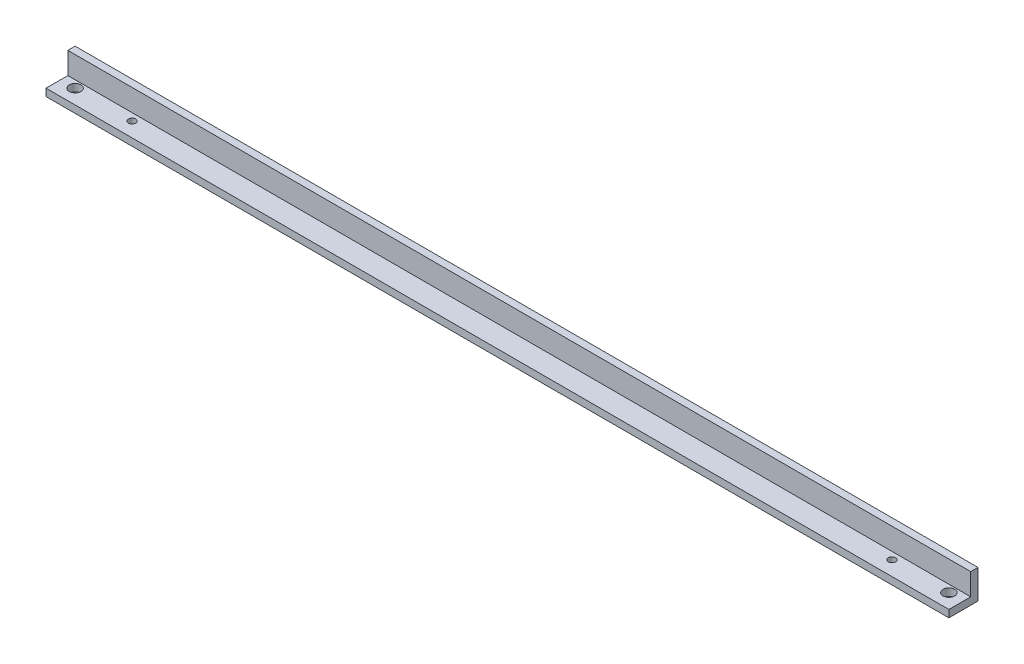
from build123d import *

# Parameters (mm, degrees)
BOSS_EXTRUDE1_DEPTH = 787.4
SKETCH2_R           = 5.08
SKETCH2_R_2         = 3.175
CUT_EXTRUDE1_DEPTH  = 914.4


with BuildPart() as part:
    # Sketch1 → Boss-Extrude1 (new body)
    with BuildSketch(Plane(origin=(0, 0, 0), x_dir=(0, 0, -1), z_dir=(1, 0, 0))):
        Polygon((0, 0), (0, 19.05), (6.35, 19.05), (6.35, -6.35), (-19.05, -6.35), (-19.05, 0), align=None)
    extrude(amount=BOSS_EXTRUDE1_DEPTH)

    # Sketch2 → Cut-Extrude1 (cut)
    with BuildSketch(Plane.XZ.offset(6.35)):
        with Locations(Location((12.7, 6.35, 0), (0, 0, 270))):
            Circle(SKETCH2_R)
        with Locations(Location((62.357, 6.35, 0), (0, 0, 270))):
            Circle(SKETCH2_R_2)
        with Locations(Location((725.043, 6.35, 0), (0, 0, 270))):
            Circle(SKETCH2_R_2)
        with Locations(Location((774.7, 6.35, 0), (0, 0, 270))):
            Circle(SKETCH2_R)
    extrude(amount=-CUT_EXTRUDE1_DEPTH, mode=Mode.SUBTRACT)


solid = part.part
